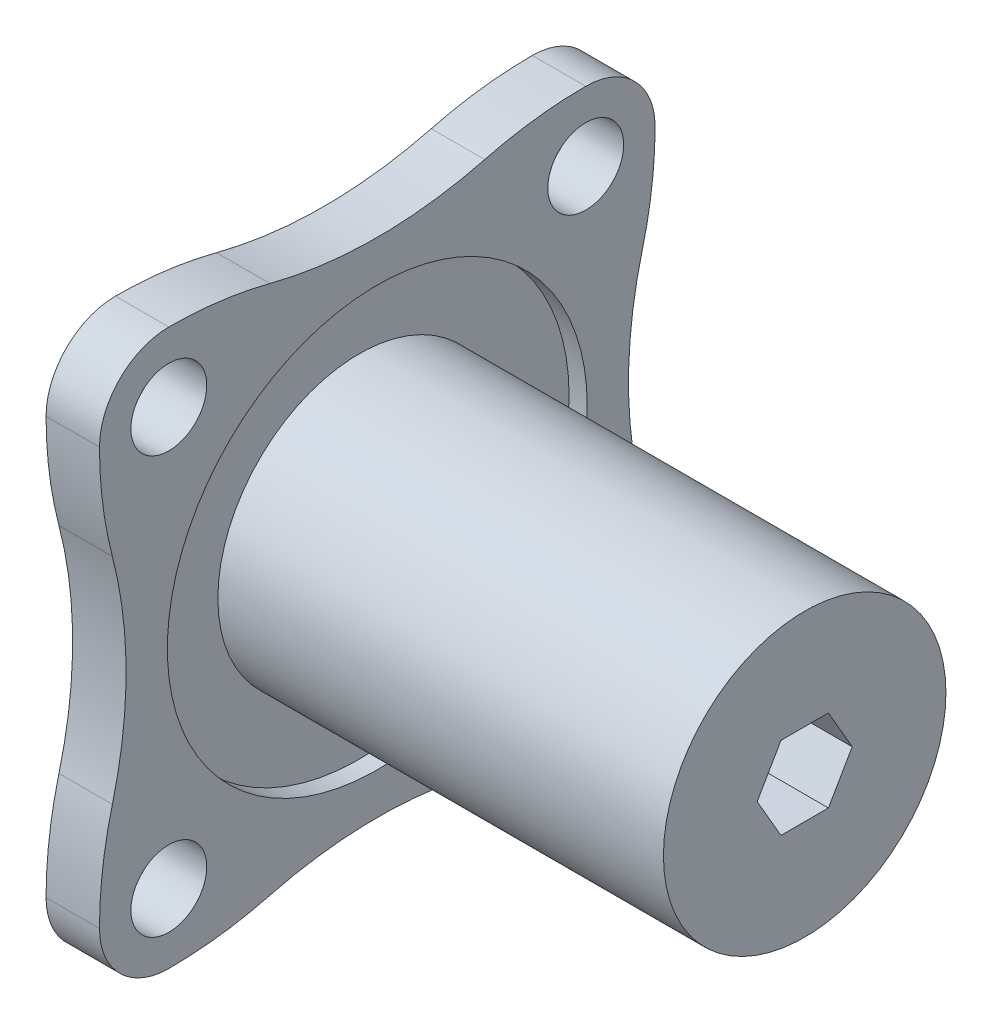
from build123d import *

# Parameters (mm, degrees)
SKETCH1_R           = 16.7894
BOSS_EXTRUDE1_DEPTH = 50.8
SKETCH2_R           = 4.5085
BOSS_EXTRUDE2_DEPTH = 6.35
CUT_EXTRUDE1_START  = -2.159
SKETCH3_R           = 24.9555
SKETCH3_R_2         = 16.7894
CUT_EXTRUDE1_DEPTH  = 2.159


with BuildPart() as part:
    # Sketch1 → Boss-Extrude1 (new body)
    with BuildSketch(Plane(origin=(0, 0, 0), x_dir=(0, 0, -1), z_dir=(1, 0, 0))):
        Circle(SKETCH1_R)
        Polygon((-2.822954141, -4.8895), (2.822954141, -4.8895), (5.645908282, 0), (2.822954141, 4.8895), (-2.822954141, 4.8895), (-5.645908282, 0), align=None, mode=Mode.SUBTRACT)
    extrude(amount=BOSS_EXTRUDE1_DEPTH)

    # Sketch2 → Boss-Extrude2 (add)
    with BuildSketch(Plane.ZY):
        with BuildLine():
            ThreePointArc((-24.7777, 33.02), (-30.605886223, 30.605886223), (-33.02, 24.7777))
            ThreePointArc((-33.02, 24.7777), (-32.634975747, 18.719636617), (-31.48609891, 12.759061339))
            ThreePointArc((-31.48609891, 12.759061339), (-29.8577, 0), (-31.48609891, -12.759061339))
            ThreePointArc((-31.48609891, -12.759061339), (-32.634975747, -18.719636617), (-33.02, -24.7777))
            ThreePointArc((-33.02, -24.7777), (-30.605886223, -30.605886223), (-24.7777, -33.02))
            ThreePointArc((-24.7777, -33.02), (-18.719636617, -32.634975747), (-12.759061339, -31.48609891))
            ThreePointArc((-12.759061339, -31.48609891), (0, -29.8577), (12.759061339, -31.48609891))
            ThreePointArc((12.759061339, -31.48609891), (18.719636617, -32.634975747), (24.7777, -33.02))
            ThreePointArc((24.7777, -33.02), (30.605886223, -30.605886223), (33.02, -24.7777))
            ThreePointArc((33.02, -24.7777), (32.634975747, -18.719636617), (31.48609891, -12.759061339))
            ThreePointArc((31.48609891, -12.759061339), (29.8577, 0), (31.48609891, 12.759061339))
            ThreePointArc((31.48609891, 12.759061339), (32.634975747, 18.719636617), (33.02, 24.7777))
            ThreePointArc((33.02, 24.7777), (30.605886223, 30.605886223), (24.7777, 33.02))
            ThreePointArc((24.7777, 33.02), (18.719636617, 32.634975747), (12.759061339, 31.48609891))
            ThreePointArc((12.759061339, 31.48609891), (0, 29.8577), (-12.759061339, 31.48609891))
            ThreePointArc((-12.759061339, 31.48609891), (-18.719636617, 32.634975747), (-24.7777, 33.02))
        make_face()
        with Locations((24.7777, 24.7777)):
            Circle(SKETCH2_R, mode=Mode.SUBTRACT)
        with Locations((-24.7777, 24.7777)):
            Circle(SKETCH2_R, mode=Mode.SUBTRACT)
        with Locations((-24.7777, -24.7777)):
            Circle(SKETCH2_R, mode=Mode.SUBTRACT)
        with Locations((24.7777, -24.7777)):
            Circle(SKETCH2_R, mode=Mode.SUBTRACT)
        Polygon((2.822954141, 4.8895), (-2.822954141, 4.8895), (-5.645908282, 0), (-2.822954141, -4.8895), (2.822954141, -4.8895), (5.645908282, 0), align=None, mode=Mode.SUBTRACT)
    extrude(amount=BOSS_EXTRUDE2_DEPTH)

    # Sketch3 → Cut-Extrude1 (cut)
    with BuildSketch(Plane(origin=(0, 0, 0), x_dir=(0, 0, -1), z_dir=(1, 0, 0)).offset(CUT_EXTRUDE1_START)):
        Circle(SKETCH3_R)
        Circle(SKETCH3_R_2, mode=Mode.SUBTRACT)
    extrude(amount=CUT_EXTRUDE1_DEPTH, mode=Mode.SUBTRACT)


solid = part.part
